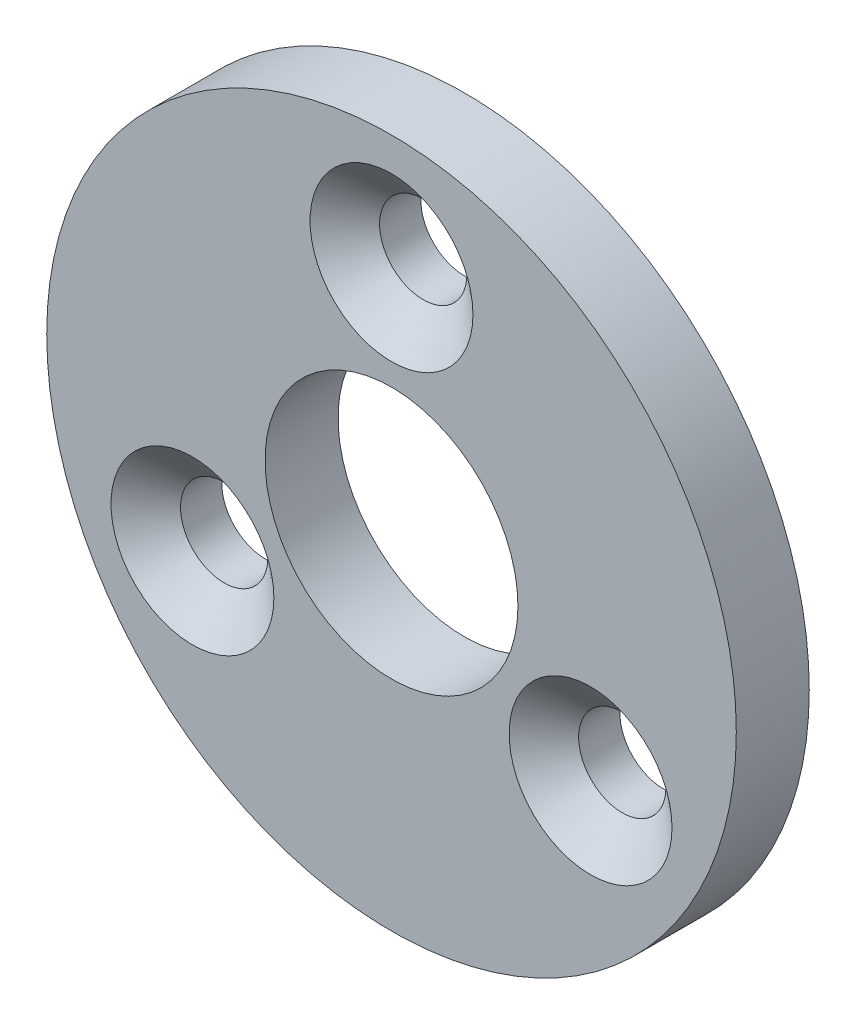
from build123d import *

# Parameters (mm, degrees)
SKETCH1_R                                         = 15
SKETCH1_R_2                                       = 5.5
BODY_DEPTH                                        = 3.175
CSK_FOR_6_FLAT_HEAD_MACHINE_SCREW_100_D           = 3.7973
CSK_FOR_6_FLAT_HEAD_MACHINE_SCREW_100_CSINK_D     = 7.0866
CSK_FOR_6_FLAT_HEAD_MACHINE_SCREW_100_CSINK_ANGLE = 100


with BuildPart() as part:
    # Sketch1 → Body (new body)
    with BuildSketch(Plane.XY):
        Circle(SKETCH1_R)
        Circle(SKETCH1_R_2, mode=Mode.SUBTRACT)
    extrude(amount=BODY_DEPTH)

    # CSK for #6 Flat Head Machine Screw (100)1 (through all)
    with Locations(Plane(origin=(0, 10, 3.175), x_dir=(1, 0, 0), z_dir=(0, 0, 1))):
        with Locations((0, 0), (-8.660254038, -15), (8.660254038, -15)):
            CounterSinkHole(CSK_FOR_6_FLAT_HEAD_MACHINE_SCREW_100_D / 2, CSK_FOR_6_FLAT_HEAD_MACHINE_SCREW_100_CSINK_D / 2, counter_sink_angle=CSK_FOR_6_FLAT_HEAD_MACHINE_SCREW_100_CSINK_ANGLE)


solid = part.part
